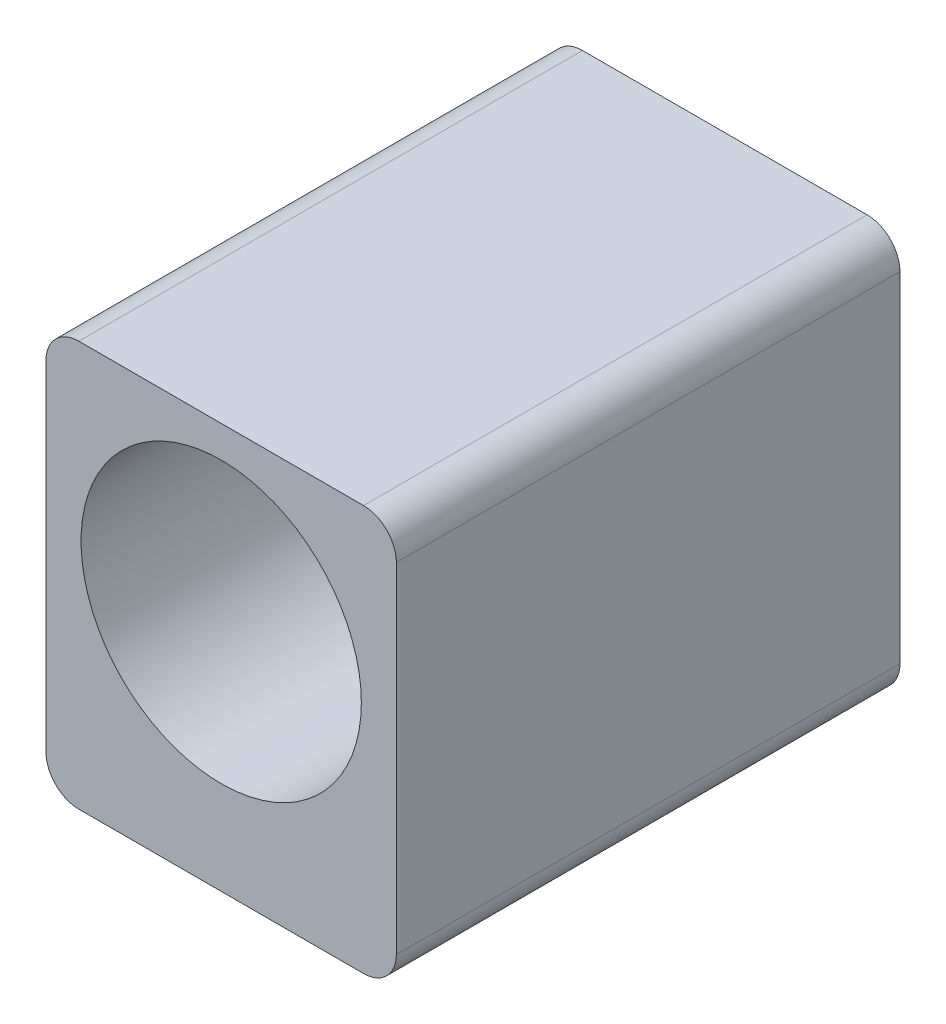
from build123d import *

# Parameters (mm, degrees)
SKETCH1_R           = 12.8
BOSS_EXTRUDE1_DEPTH = 23
SKETCH2_R           = 2
CUT_EXTRUDE1_DEPTH  = 7.5


with BuildPart() as part:
    # Sketch1 → Boss-Extrude1 (new, symmetric)
    with BuildSketch(Plane.XY):
        with BuildLine():
            Line((-13, -21.319), (13, -21.319))
            ThreePointArc((13, -21.319), (15.121320344, -20.440320344), (16, -18.319))
            Line((16, -18.319), (16, 12.7))
            ThreePointArc((16, 12.7), (15.121320344, 14.821320344), (13, 15.7))
            Line((13, 15.7), (-13, 15.7))
            ThreePointArc((-13, 15.7), (-15.121320344, 14.821320344), (-16, 12.7))
            Line((-16, 12.7), (-16, -18.319))
            ThreePointArc((-16, -18.319), (-15.121320344, -20.440320344), (-13, -21.319))
        make_face()
        Circle(SKETCH1_R, mode=Mode.SUBTRACT)
    extrude(amount=BOSS_EXTRUDE1_DEPTH, both=True)

    # Sketch2 → Cut-Extrude1 (cut)
    with BuildSketch(Plane(origin=(0, -21.319, 0), x_dir=(1, 0, 0), z_dir=(0, 1, 0))):
        with Locations(Location((12, -17.5, 0), (0, 0, 60))):
            Circle(SKETCH2_R)
        with Locations(Location((-12, 17.5, 0), (0, 0, 120))):
            Circle(SKETCH2_R)
    extrude(amount=CUT_EXTRUDE1_DEPTH, mode=Mode.SUBTRACT)


solid = part.part
